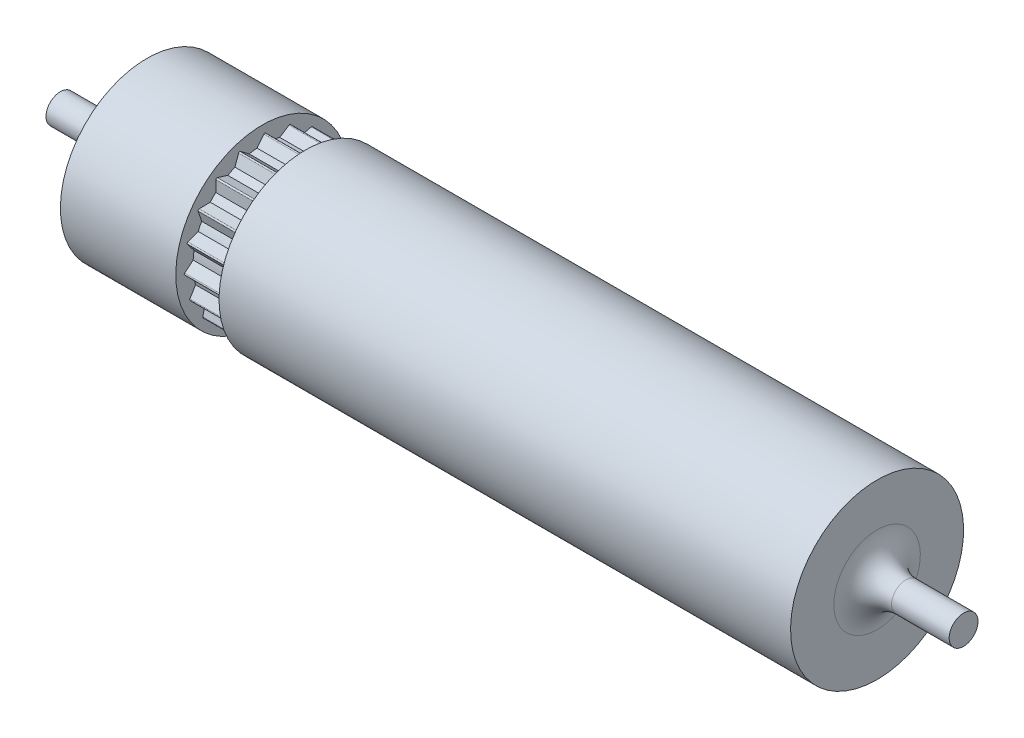
from build123d import *

# Parameters (mm, degrees)
CONG_1_R                     = 5
BOSS_EXTRU_1_DEPTH           = 7.5
R_P_TITION_CIRCULAIRE1_COUNT = 19


with BuildPart() as part:
    # Esquisse1 → Révolution1 (revolve)
    with BuildSketch(Plane.XY, mode=Mode.PRIVATE) as r_volution1_sk:
        Polygon((-78.3, 0), (-78.3, 2.5), (-63.3, 2.5), (-63.3, 15), (-43.3, 15), (-43.3, 12), (-35.8, 12), (-35.8, 15), (63.3, 15), (63.3, 2.5), (78.3, 2.5), (78.3, 0), align=None)
    revolve(r_volution1_sk.sketch.rotate(Axis((-78.3, 0, 0), (1, 0, 0)), 180), axis=Axis((-78.3, 0, 0), (1, 0, 0)))

    # Congé1
    cong_1_edges = [part.edges().sort_by_distance(p)[0] for p in [
        (63.3, 2.5, 0),
        (-63.3, 2.5, 0),
    ]]
    fillet(cong_1_edges, radius=CONG_1_R)

    # Esquisse3 → Boss.-Extru.1 (add)
    with BuildSketch(Plane(origin=(-43.3, 0, 0), x_dir=(0, 0, -1), z_dir=(1, 0, 0))):
        with BuildLine():
            Line((0.601733572, 13.451614371), (2.134408168, 11.226678946))
            Line((2.134408168, 11.226678946), (-1.394925929, 11.342318989))
            Line((-1.394925929, 11.342318989), (0.280106761, 13.462152602))
            ThreePointArc((0.280106761, 13.462152602), (0.443579587, 13.538049), (0.601733572, 13.451614371))
        make_face()
    boss_extru_1 = extrude(amount=BOSS_EXTRU_1_DEPTH)

    # Répétition circulaire1: Boss.-Extru.1 ×19 about axis
    r_p_tition_circulaire1_axis = Axis((0, 0, 0), (1, 0, 0))
    for i in range(1, R_P_TITION_CIRCULAIRE1_COUNT):
        add(boss_extru_1.rotate(r_p_tition_circulaire1_axis, i * 360 / R_P_TITION_CIRCULAIRE1_COUNT))


solid = part.part
